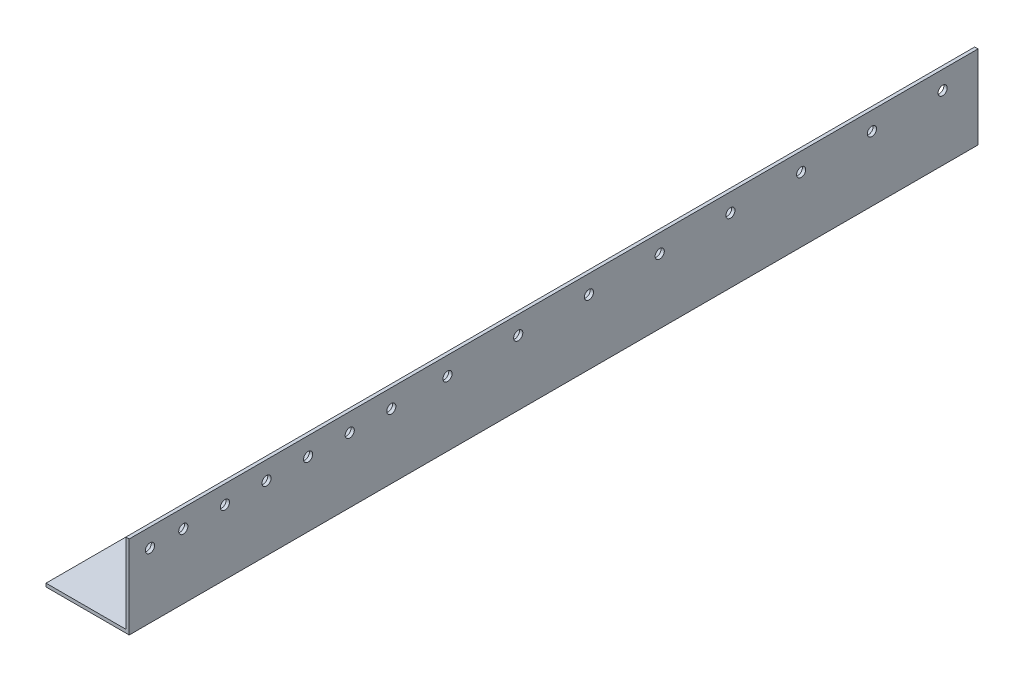
from build123d import *

# Parameters (mm, degrees)
BOSS_EXTRUDE1_DEPTH = 510
SKETCH2_R           = 2.75
CUT_EXTRUDE1_DEPTH  = 5


with BuildPart() as part:
    # Sketch1 → Boss-Extrude1 (new body)
    with BuildSketch(Plane.XY):
        Polygon((0, 0), (-50, 0), (-50, 2), (-2, 2), (-2, 50), (0, 50), align=None)
    extrude(amount=BOSS_EXTRUDE1_DEPTH)

    # Sketch2 → Cut-Extrude1 (cut, symmetric)
    with BuildSketch(Plane(origin=(0, 0, 0), x_dir=(0, 0, -1), z_dir=(1, 0, 0))):
        with Locations((-21.25, 39)):
            Circle(SKETCH2_R)
        with Locations((-63.75, 39)):
            Circle(SKETCH2_R)
        with Locations((-106.25, 39)):
            Circle(SKETCH2_R)
        with Locations((-148.75, 39)):
            Circle(SKETCH2_R)
        with Locations((-191.25, 39)):
            Circle(SKETCH2_R)
        with Locations((-233.75, 39)):
            Circle(SKETCH2_R)
        with Locations((-276.25, 39)):
            Circle(SKETCH2_R)
        with Locations((-318.75, 39)):
            Circle(SKETCH2_R)
        with Locations((-352.5, 39)):
            Circle(SKETCH2_R)
        with Locations((-377.5, 39)):
            Circle(SKETCH2_R)
        with Locations((-402.5, 39)):
            Circle(SKETCH2_R)
        with Locations((-427.5, 39)):
            Circle(SKETCH2_R)
        with Locations((-452.5, 39)):
            Circle(SKETCH2_R)
        with Locations((-477.5, 39)):
            Circle(SKETCH2_R)
        with Locations((-497.5, 39)):
            Circle(SKETCH2_R)
    extrude(amount=CUT_EXTRUDE1_DEPTH, both=True, mode=Mode.SUBTRACT)


solid = part.part
